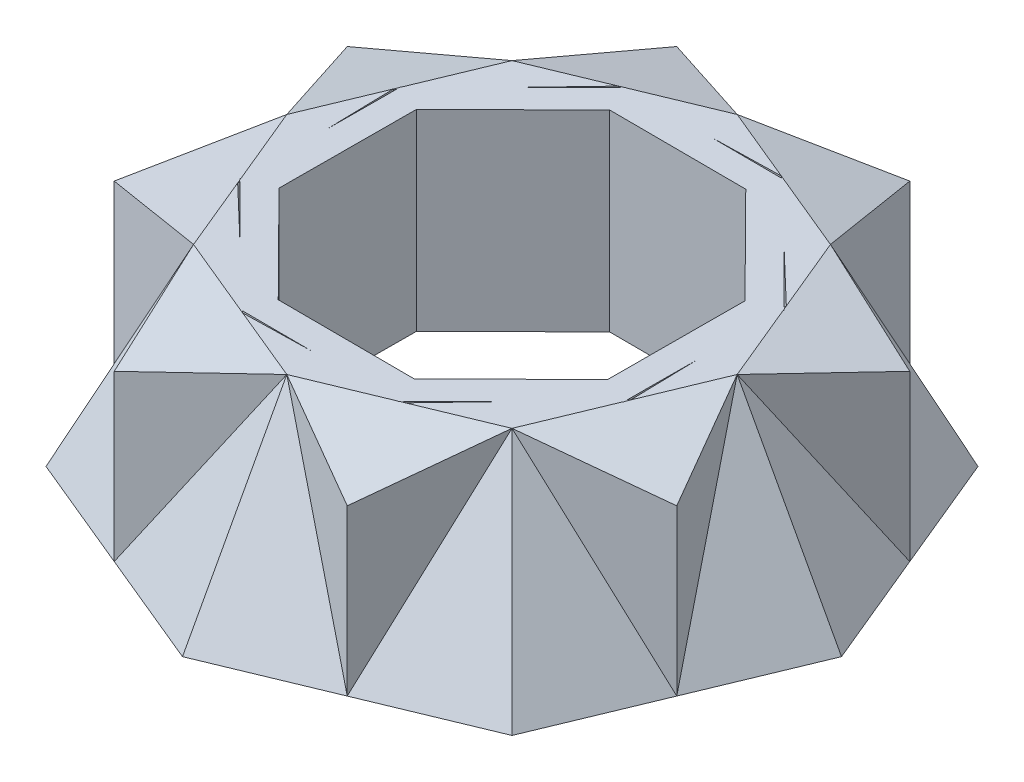
from build123d import *

# Parameters (mm, degrees)
EXTRUDE_1_DEPTH          = 35
SKETCH_2_W               = 169.230233196
SKETCH_2_H               = 74.455164588
CUT_EXTRUDE_1_DEPTH      = 35
PATTERN_CIRCULAR_1_COUNT = 8
EXTRUDE_3_REACH          = 93.788
SKETCH_8_W               = 72.944035138
SKETCH_8_H               = 43.486986799
CUT_EXTRUDE_2_DEPTH      = 41
PATTERN_CIRCULAR_2_COUNT = 8
EXTRUDE_5_DEPTH          = 35


with BuildPart() as part:
    # 草图1 → 凸台-拉伸1 (new body)
    with BuildSketch(Plane(origin=(0, 0, 0), x_dir=(1, 0, 0), z_dir=(0, 1, 0))):
        Polygon((42.426406871, 42.426406871), (0, 60), (-42.426406871, 42.426406871), (-60, 0), (-42.426406871, -42.426406871), (0, -60), (42.426406871, -42.426406871), (60, 0), align=None)
        Polygon((-35.322587829, 13.715151686), (-15.278764621, 34.674918145), (13.715151686, 35.322587829), (34.674918145, 15.278764621), (35.322587829, -13.715151686), (15.278764621, -34.674918145), (-13.715151686, -35.322587829), (-34.674918145, -15.278764621), align=None, mode=Mode.SUBTRACT)
    extrude(amount=EXTRUDE_1_DEPTH)

    # 草图2 → 切除-拉伸1 (cut)
    with BuildSketch(Plane(origin=(16.951009127, 22.211339006, 40.92335613), x_dir=(-0.9396689321581922, 0.1631822574241156, 0.3006556980977619), z_dir=(-0.34208522028389776, -0.4482429771553029, -0.8258667782967589))):
        Rectangle(SKETCH_2_W, SKETCH_2_H)
    cut_extrude_1 = extrude(amount=-CUT_EXTRUDE_1_DEPTH, mode=Mode.SUBTRACT)

    # 阵列(圆周)1: 切除-拉伸1 ×8 about axis
    pattern_circular_1_axis = Axis((0, -1.75, 0), (0, 1, 0))
    for i in range(1, PATTERN_CIRCULAR_1_COUNT):
        add(cut_extrude_1.rotate(pattern_circular_1_axis, i * 360 / PATTERN_CIRCULAR_1_COUNT), mode=Mode.SUBTRACT)


with BuildPart() as body_2:

    # 凸台-拉伸3: up to this face of the body (flat: up to its plane)
    extrude_3_end = Plane(part.part.faces().sort_by_distance((-43.614237959, 16.402886581, -18.065608875))[0])
    # 草图4 → 凸台-拉伸3 (new, up to the picked face)
    with BuildSketch(Plane(origin=(0, 35, 0), x_dir=(1, 0, 0), z_dir=(0, 1, 0)), mode=Mode.PRIVATE) as extrude_3_sk1:
        Polygon((-28.993916307, 28.993916307), (-41.003589668, 0), (-51.213203436, 21.213203436), align=None)
    extrude_3_tool1 = split(extrude(extrude_3_sk1.sketch, amount=-EXTRUDE_3_REACH, mode=Mode.PRIVATE), bisect_by=extrude_3_end, keep=Keep.BOTH, mode=Mode.PRIVATE)
    add(extrude_3_tool1.solids().sort_by(Axis((-40.40357, 35, -16.735707), (0, -1, 0)))[0])

    # 草图8 → 切除-拉伸2 (cut)
    with BuildSketch(Plane(origin=(-11.148094105, 42.354754007, -4.617691773), x_dir=(0.9674309081483811, 0.2516440800620268, -0.027435286201077803), z_dir=(-0.2531352167502554, 0.9617320893945699, -0.10485203989220389))):
        with Locations((-29.735591841, 12.90477331)):
            Rectangle(SKETCH_8_W, SKETCH_8_H)
    extrude(amount=CUT_EXTRUDE_2_DEPTH, mode=Mode.SUBTRACT)


with BuildPart() as pattern_circular_2_1:
    # 阵列(圆周)2: pattern copy
    add(body_2.part.rotate(Axis((0, -1.75, 0), (0, 1, 0)), 1 * 360 / PATTERN_CIRCULAR_2_COUNT))


with BuildPart() as pattern_circular_2_2:
    # 阵列(圆周)2: pattern copy
    add(body_2.part.rotate(Axis((0, -1.75, 0), (0, 1, 0)), 2 * 360 / PATTERN_CIRCULAR_2_COUNT))


with BuildPart() as pattern_circular_2_3:
    # 阵列(圆周)2: pattern copy
    add(body_2.part.rotate(Axis((0, -1.75, 0), (0, 1, 0)), 3 * 360 / PATTERN_CIRCULAR_2_COUNT))


with BuildPart() as pattern_circular_2_4:
    # 阵列(圆周)2: pattern copy
    add(body_2.part.rotate(Axis((0, -1.75, 0), (0, 1, 0)), 4 * 360 / PATTERN_CIRCULAR_2_COUNT))


with BuildPart() as pattern_circular_2_5:
    # 阵列(圆周)2: pattern copy
    add(body_2.part.rotate(Axis((0, -1.75, 0), (0, 1, 0)), 5 * 360 / PATTERN_CIRCULAR_2_COUNT))


with BuildPart() as pattern_circular_2_6:
    # 阵列(圆周)2: pattern copy
    add(body_2.part.rotate(Axis((0, -1.75, 0), (0, 1, 0)), 6 * 360 / PATTERN_CIRCULAR_2_COUNT))


with BuildPart() as pattern_circular_2_7:
    # 阵列(圆周)2: pattern copy
    add(body_2.part.rotate(Axis((0, -1.75, 0), (0, 1, 0)), 7 * 360 / PATTERN_CIRCULAR_2_COUNT))


with BuildPart() as part_1:
    add(part.part)

    add(body_2.part)  # 凸台-拉伸5 merges body 2

    add(pattern_circular_2_1.part)  # 凸台-拉伸5 merges 阵列(圆周)2_1

    add(pattern_circular_2_2.part)  # 凸台-拉伸5 merges 阵列(圆周)2_2

    add(pattern_circular_2_3.part)  # 凸台-拉伸5 merges 阵列(圆周)2_3

    add(pattern_circular_2_4.part)  # 凸台-拉伸5 merges 阵列(圆周)2_4

    add(pattern_circular_2_5.part)  # 凸台-拉伸5 merges 阵列(圆周)2_5

    add(pattern_circular_2_6.part)  # 凸台-拉伸5 merges 阵列(圆周)2_6

    add(pattern_circular_2_7.part)  # 凸台-拉伸5 merges 阵列(圆周)2_7
    # 草图9 → 凸台-拉伸5 (add)
    with BuildSketch(Plane(origin=(0, 0, 0), x_dir=(1, 0, 0), z_dir=(0, 1, 0))):
        Polygon((-34.99169127, 14.657982113), (-35.107620733, -14.378103631), (-14.657982113, -34.99169127), (14.378103631, -35.107620733), (34.99169127, -14.657982113), (35.107620733, 14.378103631), (14.657982113, 34.99169127), (-14.378103631, 35.107620733), align=None)
        Polygon((12.327015165, -30.099391706), (30, -12.56696797), (30.099391706, 12.327015165), (12.56696797, 30), (-12.327015165, 30.099391706), (-30, 12.56696797), (-30.099391706, -12.327015165), (-12.56696797, -30), align=None, mode=Mode.SUBTRACT)
    extrude(amount=EXTRUDE_5_DEPTH)


solid = part_1.part
